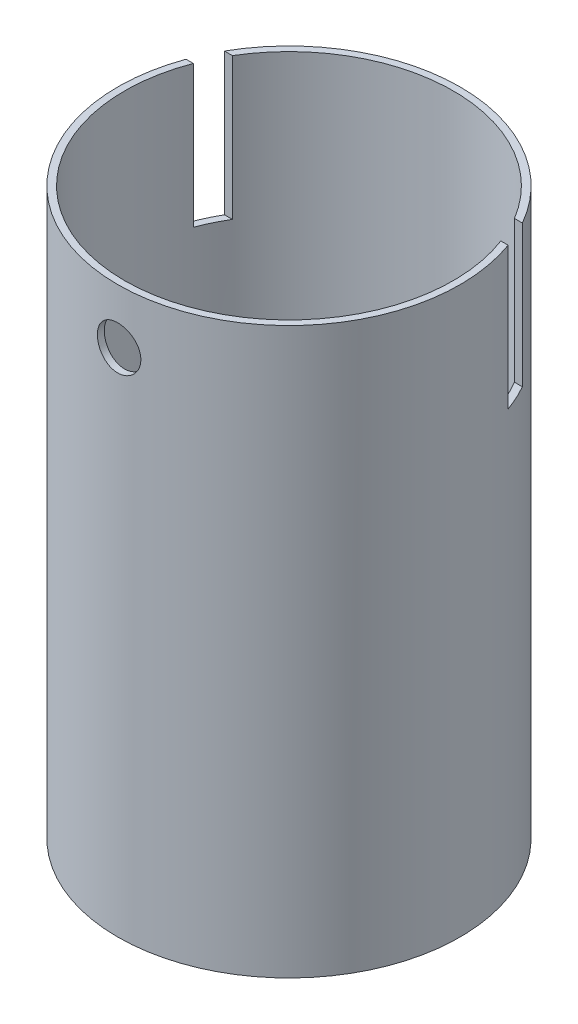
from build123d import *
from OCP.BRepFilletAPI import BRepFilletAPI_MakeChamfer

# Parameters (mm, degrees)
SKETCH2_R                = 50
BOSS_EXTRUDE1_DEPTH      = 165
SKETCH3_R                = 48
CUT_EXTRUDE1_DEPTH       = 163
SKETCH4_W                = 24.4
SKETCH4_H                = 6
CUT_EXTRUDE2_DEPTH       = 2
SKETCH5_W                = 28.4
SKETCH5_H                = 10
SKETCH5_W_2              = 24.4
SKETCH5_H_2              = 6
BOSS_EXTRUDE2_DEPTH      = 36
SKETCH6_W                = 24.4
SKETCH6_H                = 2
CUT_EXTRUDE3_DEPTH       = 8
SKETCH6_4_W              = 24.4
SKETCH6_4_H              = 2
CUT_EXTRUDE4_DEPTH       = 30
BOSS_EXTRUDE3_DEPTH      = 3
FILLET1_R                = 0.5
FILLET1_OF_MIRROR1_R     = 0.5
SKETCH8_W                = 4
SKETCH8_H                = 17.78
BOSS_EXTRUDE4_DEPTH      = 6
FILLET2_R                = 3
SKETCH10_W               = 8.128
SKETCH10_H               = 2.54
CUT_EXTRUDE5_DEPTH       = 4
FILLET2_OF_MIRROR3_R     = 3
BOSS_EXTRUDE5_REACH      = 173.006
BOSS_EXTRUDE5_END_RADIUS = 48
SKETCH11_W               = 4
SKETCH11_H               = 6
SKETCH14_R               = 1.5
CUT_EXTRUDE6_DEPTH       = 4.5
SKETCH15_W               = 110
SKETCH15_H               = 7.687081307
CUT_EXTRUDE7_DEPTH       = 41.42
SKETCH18_R               = 6.35
CUT_EXTRUDE9_DEPTH       = 8
CHAMFER1_SIZE            = 5
CHAMFER1_SIZE2           = 18.660254038


with BuildPart() as part:
    # Sketch2 → Boss-Extrude1 (new body)
    with BuildSketch(Plane(origin=(0, 0, 0), x_dir=(1, 0, 0), z_dir=(0, 1, 0))):
        with Locations(Location((0, 0, 0), (0, 0, 270))):
            Circle(SKETCH2_R)
    extrude(amount=BOSS_EXTRUDE1_DEPTH)

    # Sketch3 → Cut-Extrude1 (cut)
    with BuildSketch(Plane(origin=(0, 165, 0), x_dir=(1, 0, 0), z_dir=(0, 1, 0))):
        with Locations(Location((0, 0, 0), (0, 0, 270))):
            Circle(SKETCH3_R)
    extrude(amount=-CUT_EXTRUDE1_DEPTH, mode=Mode.SUBTRACT)

    # Sketch4 → Cut-Extrude2 (cut)
    with BuildSketch(Plane.XZ):
        with Locations((-0.785388195, -32.164171425)):
            Rectangle(SKETCH4_W, SKETCH4_H)
    extrude(amount=-CUT_EXTRUDE2_DEPTH, mode=Mode.SUBTRACT)

    # Sketch5 → Boss-Extrude2 (add)
    with BuildSketch(Plane(origin=(0, 2, 0), x_dir=(1, 0, 0), z_dir=(0, 1, 0))):
        with Locations((-0.785388195, 32.164171425)):
            Rectangle(SKETCH5_W, SKETCH5_H)
        with Locations((-0.785388195, 32.164171425)):
            Rectangle(SKETCH5_W_2, SKETCH5_H_2, mode=Mode.SUBTRACT)
    extrude(amount=BOSS_EXTRUDE2_DEPTH)

    # Sketch6 → Cut-Extrude3 (cut)
    with BuildSketch(Plane(origin=(0, 38, 0), x_dir=(1, 0, 0), z_dir=(0, 1, 0))):
        with Locations((-0.785388195, 28.164171425)):
            Rectangle(SKETCH6_W, SKETCH6_H)
    extrude(amount=-CUT_EXTRUDE3_DEPTH, mode=Mode.SUBTRACT)

    # Sketch6<4> → Cut-Extrude4 (cut)
    with BuildSketch(Plane(origin=(0, 38, 0), x_dir=(1, 0, 0), z_dir=(0, 1, 0))):
        with Locations((-0.785388195, 36.164171425)):
            Rectangle(SKETCH6_4_W, SKETCH6_4_H)
    extrude(amount=-CUT_EXTRUDE4_DEPTH, mode=Mode.SUBTRACT)

    # Sketch7 → Boss-Extrude3 (add)
    with BuildSketch(Plane(origin=(0, 2, 0), x_dir=(1, 0, 0), z_dir=(0, 1, 0))):
        Polygon((-30.4, 18.2), (-24.4, 18.2), (-24.4, 20.2), (-32.4, 20.2), (-32.4, 12.2), (-30.4, 12.2), align=None)
        Polygon((-30.4, -27), (-24.4, -27), (-24.4, -29), (-32.4, -29), (-32.4, -21), (-30.4, -21), align=None)
        Polygon((-4, 18.2), (-4, 12.2), (-2, 12.2), (-2, 20.2), (-10, 20.2), (-10, 18.2), align=None)
        Polygon((-10, -27), (-10, -29), (-2, -29), (-2, -21), (-4, -21), (-4, -27), align=None)
    boss_extrude3 = extrude(amount=BOSS_EXTRUDE3_DEPTH)

    # Fillet1
    fillet1_edges = [part.edges().sort_by_distance(p)[0] for p in [
        (-7, 5, 27),
        (-10, 5, 28),
        (-6, 5, 29),
        (-2, 5, 25),
        (-3, 5, 21),
        (-4, 5, 24),
        (-30.4, 5, 24),
        (-31.4, 5, 21),
        (-32.4, 5, 25),
        (-28.4, 5, 29),
        (-24.4, 5, 28),
        (-27.4, 5, 27),
        (-7, 5, -18.2),
        (-4, 5, -15.2),
        (-3, 5, -12.2),
        (-2, 5, -16.2),
        (-6, 5, -20.2),
        (-10, 5, -19.2),
        (-30.4, 5, -15.2),
        (-27.4, 5, -18.2),
        (-24.4, 5, -19.2),
        (-28.4, 5, -20.2),
        (-32.4, 5, -16.2),
        (-31.4, 5, -12.2),
    ]]
    fillet(fillet1_edges, radius=FILLET1_R)

    # Mirror1: Boss-Extrude3 across plane
    add(boss_extrude3.mirror(Plane(origin=(0, 0, 0), x_dir=(0, 0, 1), z_dir=(1, 0, 0))))

    # Fillet1 of Mirror1
    fillet1_of_mirror1_edges = [part.edges().sort_by_distance(p)[0] for p in [
        (7, 5, 27),
        (10, 5, 28),
        (6, 5, 29),
        (2, 5, 25),
        (3, 5, 21),
        (4, 5, 24),
        (30.4, 5, 24),
        (31.4, 5, 21),
        (32.4, 5, 25),
        (28.4, 5, 29),
        (24.4, 5, 28),
        (27.4, 5, 27),
        (7, 5, -18.2),
        (4, 5, -15.2),
        (3, 5, -12.2),
        (2, 5, -16.2),
        (6, 5, -20.2),
        (10, 5, -19.2),
        (30.4, 5, -15.2),
        (27.4, 5, -18.2),
        (24.4, 5, -19.2),
        (28.4, 5, -20.2),
        (32.4, 5, -16.2),
        (31.4, 5, -12.2),
    ]]
    fillet(fillet1_of_mirror1_edges, radius=FILLET1_OF_MIRROR1_R)

    # Sketch8 → Boss-Extrude4 (add)
    with BuildSketch(Plane(origin=(0, 2, 0), x_dir=(1, 0, 0), z_dir=(0, 1, 0))):
        with Locations((-39.9, 0)):
            Rectangle(SKETCH8_W, SKETCH8_H)
    boss_extrude4 = extrude(amount=BOSS_EXTRUDE4_DEPTH)

    # Fillet2
    fillet2_edges = [part.edges().sort_by_distance(p)[0] for p in [
        (-39.9, 8, 8.89),
        (-39.9, 8, -8.89),
    ]]
    fillet(fillet2_edges, radius=FILLET2_R)

    # Sketch10 → Cut-Extrude5 (cut)
    with BuildSketch(Plane(origin=(-37.9, 0, 0), x_dir=(0, 0, -1), z_dir=(1, 0, 0))):
        with Locations((0, 3.27)):
            Rectangle(SKETCH10_W, SKETCH10_H)
    cut_extrude5 = extrude(amount=-CUT_EXTRUDE5_DEPTH, mode=Mode.SUBTRACT)

    # Mirror3: Boss-Extrude4, Cut-Extrude5 across plane
    add(boss_extrude4.mirror(Plane(origin=(0, 0, 0), x_dir=(0, 0, 1), z_dir=(1, 0, 0))))
    add(cut_extrude5.mirror(Plane(origin=(0, 0, 0), x_dir=(0, 0, 1), z_dir=(1, 0, 0))), mode=Mode.SUBTRACT)

    # Fillet2 of Mirror3
    fillet2_of_mirror3_edges = [part.edges().sort_by_distance(p)[0] for p in [
        (39.9, 8, 8.89),
        (39.9, 8, -8.89),
    ]]
    fillet(fillet2_of_mirror3_edges, radius=FILLET2_OF_MIRROR3_R)

    # Boss-Extrude5: up to this cylinder (the profile starts inside it)
    boss_extrude5_end = Plane(origin=(0, 104.388479, 0), z_dir=(0, 1, 0)) * Cylinder(BOSS_EXTRUDE5_END_RADIUS, 443.012, mode=Mode.PRIVATE)
    # Sketch11 → Boss-Extrude5 (add, up to the surface)
    with BuildSketch(Plane(origin=(-60.081997982, 96.731112478, 38.136861184), x_dir=(1, 0, 0), z_dir=(0, 0, 1)), mode=Mode.PRIVATE) as boss_extrude5_sk1:
        with Locations((69.462057176, 7.657366935)):
            Rectangle(SKETCH11_W, SKETCH11_H)
    boss_extrude5_tool1 = extrude(boss_extrude5_sk1.sketch, amount=BOSS_EXTRUDE5_REACH, mode=Mode.PRIVATE) & boss_extrude5_end
    add(boss_extrude5_tool1.solids().sort_by_distance((9.380059, 104.388479, 38.136861))[0])
    # Sketch11 → Boss-Extrude5 (add, up to the surface)
    with BuildSketch(Plane(origin=(-60.081997982, 96.731112478, 38.136861184), x_dir=(1, 0, 0), z_dir=(0, 0, 1)), mode=Mode.PRIVATE) as boss_extrude5_sk2:
        with Locations((41.292057176, 7.657366935)):
            Rectangle(SKETCH11_W, SKETCH11_H)
    boss_extrude5_tool2 = extrude(boss_extrude5_sk2.sketch, amount=BOSS_EXTRUDE5_REACH, mode=Mode.PRIVATE) & boss_extrude5_end
    add(boss_extrude5_tool2.solids().sort_by_distance((-18.789941, 104.388479, 38.136861))[0])

    # Sketch14 → Cut-Extrude6 (cut)
    with BuildSketch(Plane(origin=(0, 0, 38.136861184), x_dir=(-1, 0, 0), z_dir=(0, 0, -1))):
        with Locations((-9.380059194, 105.331815543)):
            Circle(SKETCH14_R)
        with Locations((18.789940806, 105.331815543)):
            Circle(SKETCH14_R)
    extrude(amount=-CUT_EXTRUDE6_DEPTH, mode=Mode.SUBTRACT)

    # Sketch15 → Cut-Extrude7 (cut)
    with BuildSketch(Plane(origin=(0, 165, 0), x_dir=(1, 0, 0), z_dir=(0, 1, 0))):
        with Locations((0, 20.820630771)):
            Rectangle(SKETCH15_W, SKETCH15_H)
    extrude(amount=-CUT_EXTRUDE7_DEPTH, mode=Mode.SUBTRACT)

    # Sketch18 → Cut-Extrude9 (cut)
    with BuildSketch(Plane.XY.offset(50)):
        with Locations((0, 149)):
            Circle(SKETCH18_R)
    extrude(amount=-CUT_EXTRUDE9_DEPTH, mode=Mode.SUBTRACT)

    # Chamfer1: one chamfer whose edges measure the first distance from different faces: ONE call of the kernel's chamfer builder (chamfer() names one face for all edges)
    chamfer1_edges_1 = [part.edges().sort_by_distance(p)[0] for p in [
        (-13.985388195, 38, -37.164171425),
    ]]
    chamfer1_side_1 = [part.faces().sort_by_distance(p)[0] for p in [
        (-13.985388195, 38, -32.164171425),
    ]]
    chamfer1_edges_2 = [part.edges().sort_by_distance(p)[0] for p in [
        (12.414611805, 38, -37.164171425),
    ]]
    chamfer1_side_2 = [part.faces().sort_by_distance(p)[0] for p in [
        (12.414611805, 38, -32.164171425),
    ]]
    chamfer1 = BRepFilletAPI_MakeChamfer(part.part.solid().wrapped)
    for e in chamfer1_edges_1:
        chamfer1.Add(CHAMFER1_SIZE, CHAMFER1_SIZE2, e.wrapped, chamfer1_side_1[0].wrapped)  # the first distance lies on this face
    for e in chamfer1_edges_2:
        chamfer1.Add(CHAMFER1_SIZE, CHAMFER1_SIZE2, e.wrapped, chamfer1_side_2[0].wrapped)  # the first distance lies on this face
    add(Compound.cast(chamfer1.Shape()), mode=Mode.REPLACE)


solid = part.part
